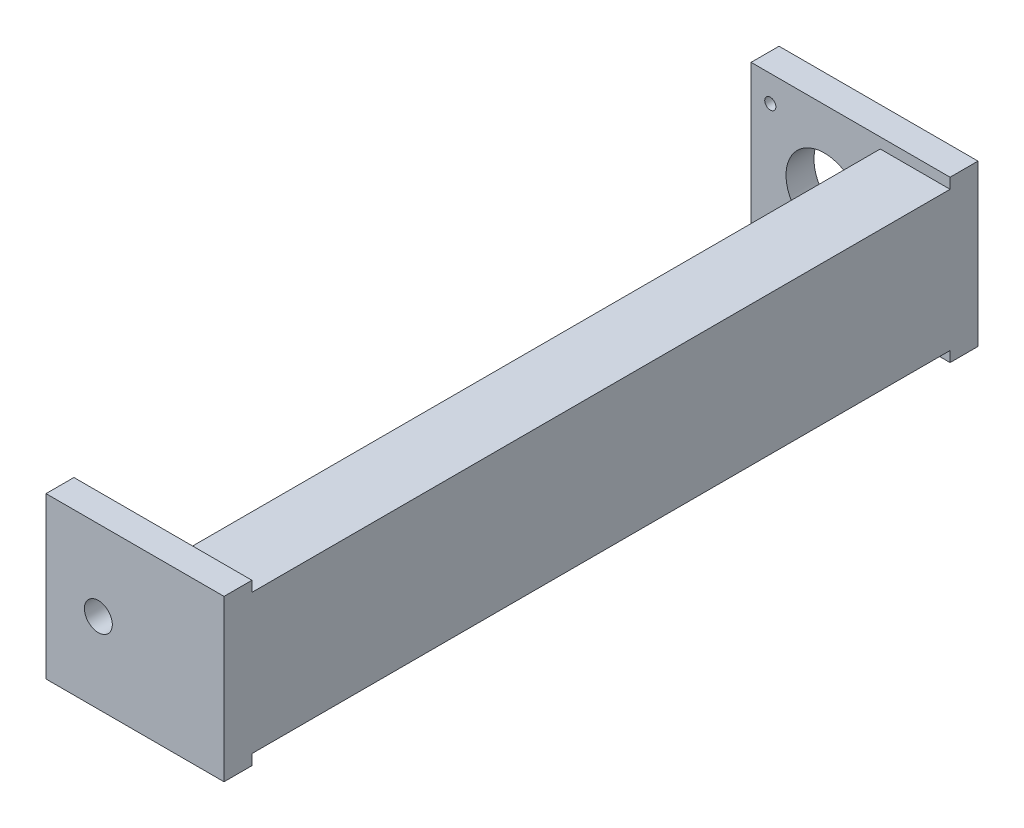
from build123d import *

# Parameters (mm, degrees)
SKETCH_1_W      = 57
SKETCH_1_H      = 46
SKETCH_1_R      = 11
SKETCH_1_R_2    = 1.6
EXTRUDE_1_DEPTH = 8
SKETCH_2_W      = 20
SKETCH_2_H      = 40
EXTRUDE_2_DEPTH = 200
SKETCH_3_W      = 51
SKETCH_3_H      = 46
SKETCH_3_R      = 4
EXTRUDE_3_DEPTH = 8


with BuildPart() as part:
    # 草图1 → 凸台-拉伸1 (new body)
    with BuildSketch(Plane.XY):
        Rectangle(SKETCH_1_W, SKETCH_1_H)
        with Locations((-7.5, 0)):
            Circle(SKETCH_1_R, mode=Mode.SUBTRACT)
        with Locations((-23, 15.5)):
            Circle(SKETCH_1_R_2, mode=Mode.SUBTRACT)
        with Locations((8, 15.5)):
            Circle(SKETCH_1_R_2, mode=Mode.SUBTRACT)
        with Locations((8, -15.5)):
            Circle(SKETCH_1_R_2, mode=Mode.SUBTRACT)
        with Locations((-23, -15.5)):
            Circle(SKETCH_1_R_2, mode=Mode.SUBTRACT)
    extrude(amount=EXTRUDE_1_DEPTH)

    # 草图2 → 凸台-拉伸2 (add)
    with BuildSketch(Plane.XY.offset(8)):
        with Locations((18.5, 0)):
            Rectangle(SKETCH_2_W, SKETCH_2_H)
    extrude(amount=EXTRUDE_2_DEPTH)

    # 草图3 → 凸台-拉伸3 (add)
    with BuildSketch(Plane.XY.offset(208)):
        with Locations((3, 0)):
            Rectangle(SKETCH_3_W, SKETCH_3_H)
        with Locations((-7.5, 0)):
            Circle(SKETCH_3_R, mode=Mode.SUBTRACT)
    extrude(amount=EXTRUDE_3_DEPTH)


solid = part.part
